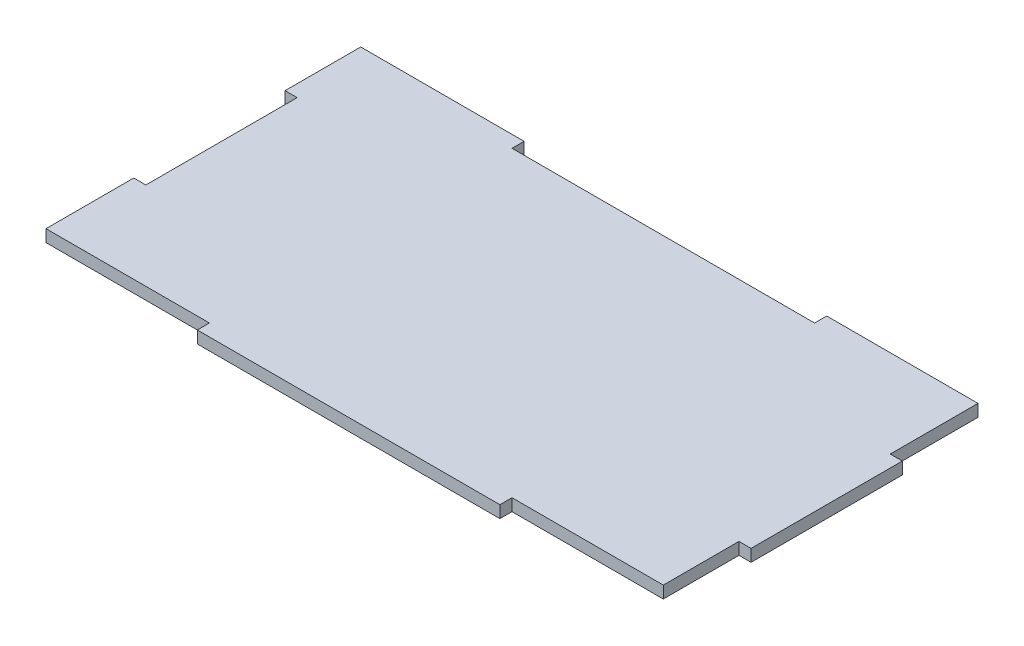
from build123d import *

# Parameters (mm, degrees)
BOSS_EXTRUDE1_DEPTH = 4


with BuildPart() as part:
    # Sketch1 → Boss-Extrude1 (new body)
    with BuildSketch(Plane(origin=(0, 0, 0), x_dir=(1, 0, 0), z_dir=(0, 1, 0))):
        Polygon((-65.738911402, 40.251271296), (-65.738911402, 44.251271296), (-119.738911402, 44.251271296), (-119.738911402, 19.251271296), (-115.738911402, 19.251271296), (-115.738911402, -30.748728704), (-119.738911402, -30.748728704), (-119.738911402, -59.748728704), (-115.738911402, -59.748728704), (-65.738911402, -59.748728704), (-65.738911402, -63.748728704), (34.261088598, -63.748728704), (34.261088598, -59.748728704), (84.261088598, -59.748728704), (84.261088598, -34.748728704), (88.261088598, -34.748728704), (88.261088598, 15.251271296), (84.261088598, 15.251271296), (84.261088598, 44.251271296), (34.261088598, 44.251271296), (34.261088598, 40.251271296), align=None)
    extrude(amount=BOSS_EXTRUDE1_DEPTH)


solid = part.part
